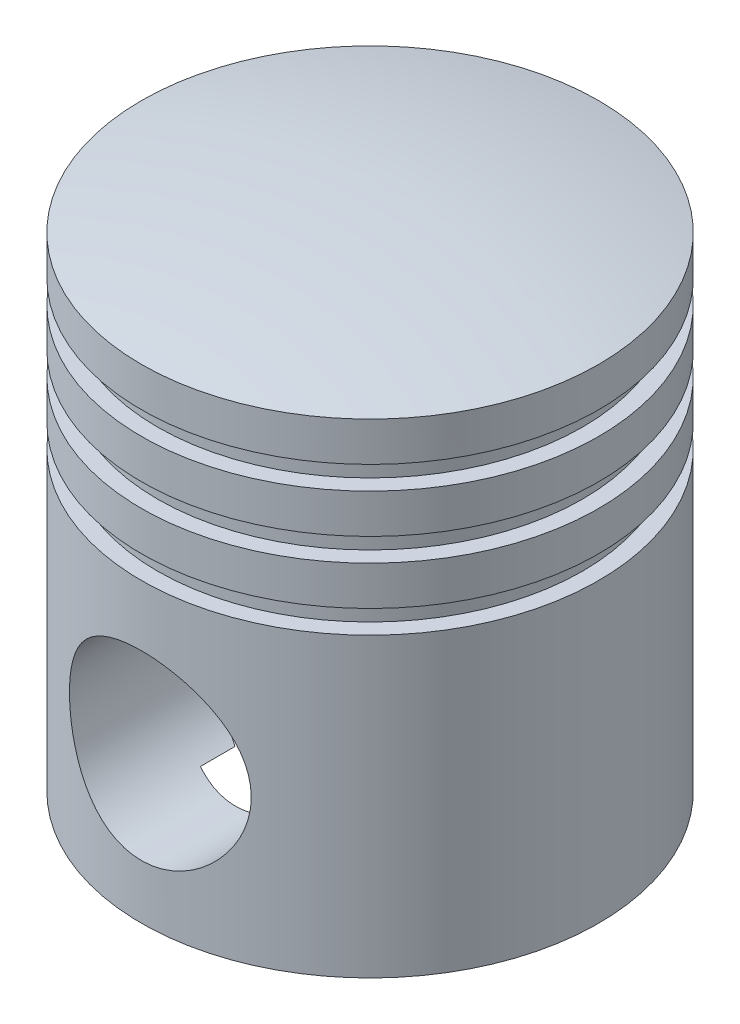
from build123d import *

# Parameters (mm, degrees)
CUT_EXTRUDE1_DEPTH      = 113.41663578
CUT_EXTRUDE1_DEPTH_BACK = 113.41663578
SKETCH6_R               = 16.9


with BuildPart() as part:
    # Sketch5 → Revolve1 (revolve)
    with BuildSketch(Plane.XY, mode=Mode.PRIVATE) as revolve1_sk:
        with BuildLine():
            Line((25, 0), (42.5, 0))
            Line((42.5, 0), (42.5, 55.2))
            Line((42.5, 55.2), (39.5, 55.2))
            Line((39.5, 55.2), (39.5, 59.5))
            Line((39.5, 59.5), (42.5, 59.5))
            Line((42.5, 59.5), (42.5, 66.8))
            Line((42.5, 66.8), (39.5, 66.8))
            Line((39.5, 66.8), (39.5, 71.1))
            Line((39.5, 71.1), (42.5, 71.1))
            Line((42.5, 71.1), (42.5, 78.4))
            Line((42.5, 78.4), (39.5, 78.4))
            Line((39.5, 78.4), (39.5, 82.7))
            Line((39.5, 82.7), (42.5, 82.7))
            Line((42.5, 82.7), (42.5, 90))
            ThreePointArc((42.5, 90), (21.396553461, 93.745704417), (0, 95))
            Line((0, 95), (0, 90))
            Line((0, 90), (0, 85))
            Line((0, 85), (38, 85))
            Line((38, 85), (38, 49.5))
            Line((38, 49.5), (19, 49.5))
            Line((19, 49.5), (19, 12))
            Line((19, 12), (25, 12))
            Line((25, 12), (25, 0))
        make_face()
    revolve(revolve1_sk.sketch.rotate(Axis((0, 0, 0), (0, 1, 0)), 90), axis=Axis((0, 0, 0), (0, 1, 0)))

    # Sketch6 → Cut-Extrude1 (cut, two sides: drawn at the far end of the back side and taken through both)
    with BuildSketch(Plane.XY.offset(-CUT_EXTRUDE1_DEPTH_BACK)):
        with Locations((0, 27)):
            Circle(SKETCH6_R)
    extrude(amount=CUT_EXTRUDE1_DEPTH + CUT_EXTRUDE1_DEPTH_BACK, mode=Mode.SUBTRACT)


solid = part.part
